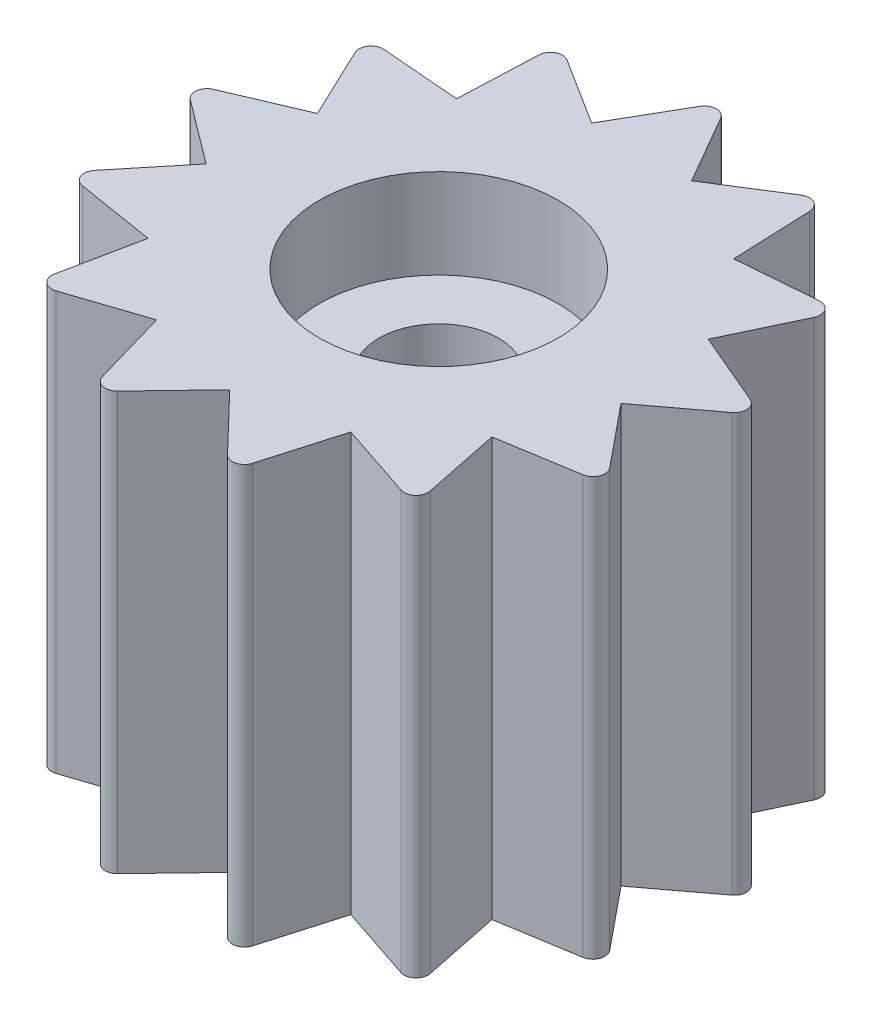
from build123d import *

# Parameters (mm, degrees)
SKETCH1_R           = 1
BOSS_EXTRUDE1_DEPTH = 7
CUT_EXTRUDE1_DEPTH  = 3
FILLET1_R           = 0.2
SKETCH3_R           = 2
CUT_EXTRUDE2_DEPTH  = 1.5


with BuildPart() as part:
    # Sketch1 → Boss-Extrude1 (new body)
    with BuildSketch(Plane(origin=(0, 0, 0), x_dir=(1, 0, 0), z_dir=(0, 1, 0))):
        Polygon((2.320929304, 2.619787619), (3.990706765, 2.754585991), (3.272556849, 1.241117105), (4.813715291, 0.584490857), (3.474481059, -0.421878381), (4.533959656, -1.719504088), (2.880443531, -1.988226614), (3.215528503, -3.629581369), (1.626531102, -3.09909609), (1.160458522, -4.708165299), (0, -3.5), (-1.160458522, -4.708165299), (-1.626531102, -3.09909609), (-3.215528503, -3.629581369), (-2.880443531, -1.988226614), (-4.533959656, -1.719504088), (-3.474481059, -0.421878381), (-4.813715291, 0.584490857), (-3.272556849, 1.241117105), (-3.990706765, 2.754585991), (-2.320929304, 2.619787619), (-2.253475412, 4.293638671), (-0.837604825, 3.398296361), (0, 4.849070475), (0.837604825, 3.398296361), (2.253475412, 4.293638671), align=None)
        with Locations(Location((0, 0, 0), (0, 0, 270))):
            Circle(SKETCH1_R, mode=Mode.SUBTRACT)
    extrude(amount=BOSS_EXTRUDE1_DEPTH)

    # Sketch2 → Cut-Extrude1 (cut)
    with BuildSketch(Plane.XZ):
        Polygon((0, 2.25), (-0.353449874, 1.662850921), (-0.915157447, 2.05547728), (-0.999234929, 1.37532889), (-1.672075857, 1.505543864), (-1.472243186, 0.85), (-2.139877162, 0.695288237), (-1.690687222, 0.177698388), (-2.237674265, -0.235189042), (-1.616796078, -0.52532889), (-1.948557159, -1.125), (-1.263346203, -1.137522031), (-1.322516818, -1.820288237), (-0.691452293, -1.553027278), (-0.467801304, -2.200832102), (0, -1.7), (0.467801304, -2.200832102), (0.691452293, -1.553027278), (1.322516818, -1.820288237), (1.263346203, -1.137522031), (1.948557159, -1.125), (1.616796078, -0.52532889), (2.237674265, -0.235189042), (1.690687222, 0.177698388), (2.139877162, 0.695288237), (1.472243186, 0.85), (1.672075857, 1.505543864), (0.999234929, 1.37532889), (0.915157447, 2.05547728), (0.353449874, 1.662850921), align=None)
    extrude(amount=-CUT_EXTRUDE1_DEPTH, mode=Mode.SUBTRACT)

    # Fillet1
    fillet1_edges = [part.edges().sort_by_distance(p)[0] for p in [
        (4.813715291, 3.5, -0.584490857),
        (4.533959656, 3.5, 1.719504088),
        (3.215528503, 3.5, 3.629581369),
        (1.160458522, 3.5, 4.708165299),
        (-1.160458522, 3.5, 4.708165299),
        (-3.215528503, 3.5, 3.629581369),
        (-4.533959656, 3.5, 1.719504088),
        (-4.813715291, 3.5, -0.584490857),
        (-3.990706765, 3.5, -2.754585991),
        (-2.253475412, 3.5, -4.293638671),
        (0, 3.5, -4.849070475),
        (2.253475412, 3.5, -4.293638671),
        (3.990706765, 3.5, -2.754585991),
    ]]
    fillet(fillet1_edges, radius=FILLET1_R)

    # Sketch3 → Cut-Extrude2 (cut)
    with BuildSketch(Plane(origin=(0, 7, 0), x_dir=(1, 0, 0), z_dir=(0, 1, 0))):
        with Locations(Location((0, 0, 0), (0, 0, 270))):
            Circle(SKETCH3_R)
    extrude(amount=-CUT_EXTRUDE2_DEPTH, mode=Mode.SUBTRACT)


solid = part.part
